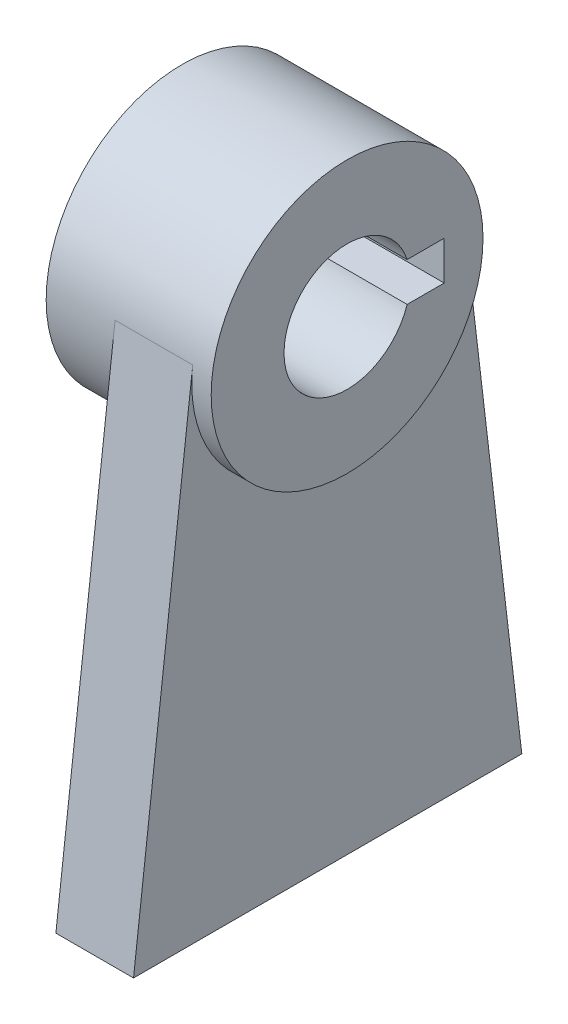
from build123d import *
from build123d.topology import SkipClean

# Parameters (mm, degrees)
SALIENTE_EXTRUIR3_DEPTH = 16
CROQUIS6_R              = 28
SALIENTE_EXTRUIR4_DEPTH = 4
SALIENTE_EXTRUIR5_START = 14
CROQUIS7_R              = 28
SALIENTE_EXTRUIR5_DEPTH = 14
CORTAR_EXTRUIR1_DEPTH   = 106.924501415


with BuildPart() as part:
    # Croquis5 → Saliente-Extruir3 (new body)
    with BuildSketch(Plane(origin=(0, 0, 0), x_dir=(0, 0, -1), z_dir=(1, 0, 0))):
        with BuildLine():
            Line((40, -36), (27.806896216, 67.282758707))
            ThreePointArc((27.806896216, 67.282758707), (-4.12e-07, 92), (-27.806896887, 67.282758534))
            Line((-27.806896887, 67.282758534), (-40, -36))
            Line((-40, -36), (40, -36))
        make_face()
    extrude(amount=SALIENTE_EXTRUIR3_DEPTH)

    # Croquis6 → Saliente-Extruir4 (add)
    with BuildSketch(Plane(origin=(16, 0, 0), x_dir=(0, 0, -1), z_dir=(1, 0, 0))):
        with Locations(Location((-3.25e-07, 64, 0), (0, 0, 173.267078851))):
            Circle(CROQUIS6_R)
    extrude(amount=SALIENTE_EXTRUIR4_DEPTH)

    # Croquis7 → Saliente-Extruir5 (add)
    with SkipClean():  # the faces are left unmerged after this step: merging them gives an invalid solid
        with BuildSketch(Plane.ZY.offset(SALIENTE_EXTRUIR5_START)):
            with Locations((3.25e-07, 64)):
                Circle(CROQUIS7_R)
        extrude(amount=-SALIENTE_EXTRUIR5_DEPTH)

    # Croquis8 → Cortar-Extruir1 (cut, through all)
    with SkipClean():  # the faces are left unmerged after this step: merging them gives an invalid solid
        with BuildSketch(Plane(origin=(20, 0, 0), x_dir=(0, 0, -1), z_dir=(1, 0, 0))):
            with BuildLine():
                Line((19.999999675, 68), (19.999999675, 60))
                Line((19.999999675, 60), (12.369316552, 60))
                ThreePointArc((12.369316552, 60), (-13.000000325, 64), (12.369316552, 68))
                Line((12.369316552, 68), (19.999999675, 68))
            make_face()
        extrude(amount=-CORTAR_EXTRUIR1_DEPTH, mode=Mode.SUBTRACT)


solid = part.part
